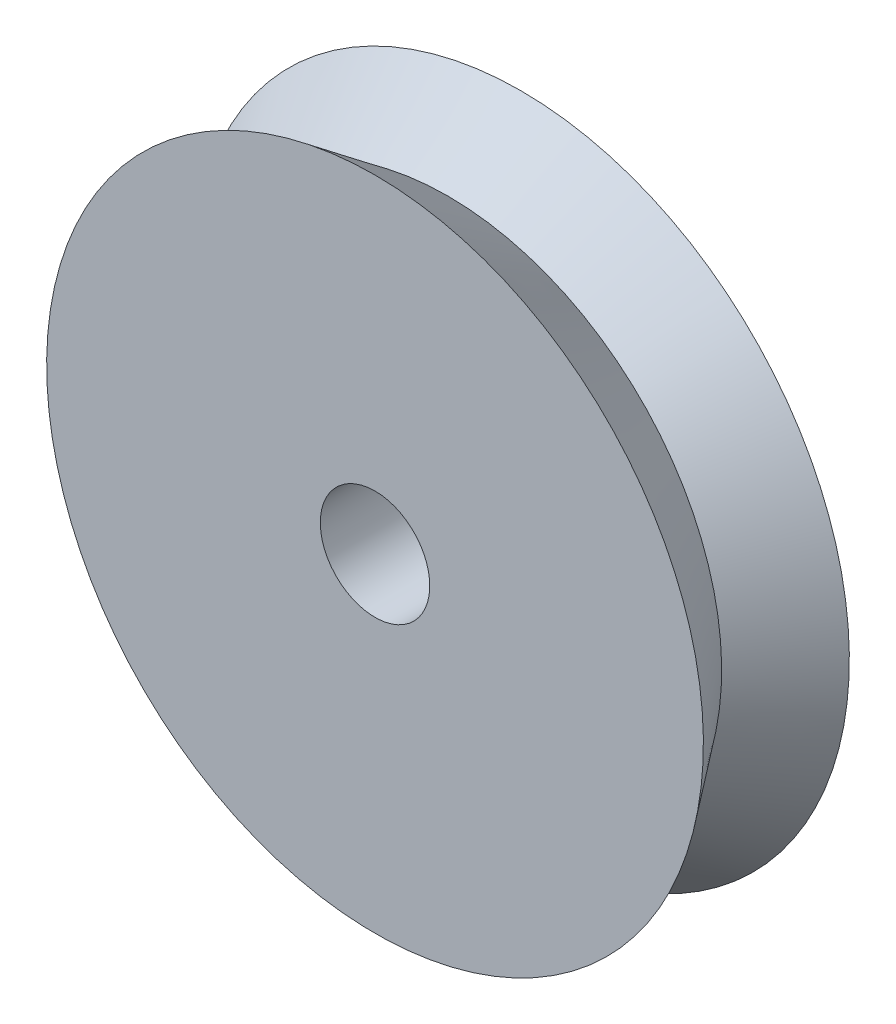
from build123d import *


with BuildPart() as part:
    # Эскиз1 → Повернуть1 (revolve)
    with BuildSketch(Plane.XZ, mode=Mode.PRIVATE) as revolve_1_sk:
        Polygon((7.5, 2), (9, 4), (1.5, 4), (1.5, 0), (9, 0), align=None)
    revolve(revolve_1_sk.sketch.rotate(Axis((0, 0, 4), (0, 0, -1)), 270), axis=Axis((0, 0, 4), (0, 0, -1)))


solid = part.part
